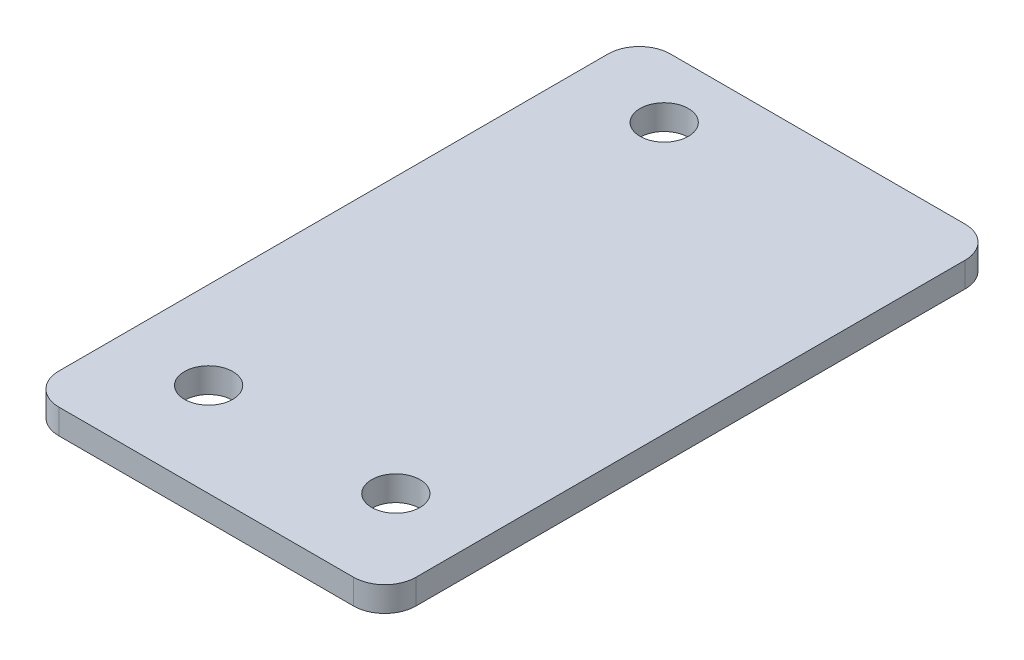
from build123d import *

# Parameters (mm, degrees)
SKETCH1_R           = 2.45745
BOSS_EXTRUDE1_DEPTH = 2.54


with BuildPart() as part:
    # Sketch1 → Boss-Extrude1 (new body)
    with BuildSketch(Plane(origin=(0, 0, 0), x_dir=(1, 0, 0), z_dir=(0, 1, 0))):
        with BuildLine():
            Line((3.175, -4.852667781), (33.16436, -4.852667781))
            ThreePointArc((33.16436, -4.852667781), (35.40942403, -3.922731811), (36.33936, -1.677667781))
            Line((36.33936, -1.677667781), (36.33936, 54.202332219))
            ThreePointArc((36.33936, 54.202332219), (35.40942403, 56.447396249), (33.16436, 57.377332219))
            Line((33.16436, 57.377332219), (3.175, 57.377332219))
            ThreePointArc((3.175, 57.377332219), (0.92993597, 56.447396249), (0, 54.202332219))
            Line((0, 54.202332219), (0, -1.677667781))
            ThreePointArc((0, -1.677667781), (0.92993597, -3.922731811), (3.175, -4.852667781))
        make_face()
        with Locations(Location((8.89, 51.027332219, 0), (0, 0, 270))):
            Circle(SKETCH1_R, mode=Mode.SUBTRACT)
        with Locations(Location((27.94, 4.672332219, 0), (0, 0, 270))):
            Circle(SKETCH1_R, mode=Mode.SUBTRACT)
        with Locations(Location((8.89, 4.672332219, 0), (0, 0, 270))):
            Circle(SKETCH1_R, mode=Mode.SUBTRACT)
    extrude(amount=-BOSS_EXTRUDE1_DEPTH)


solid = part.part
